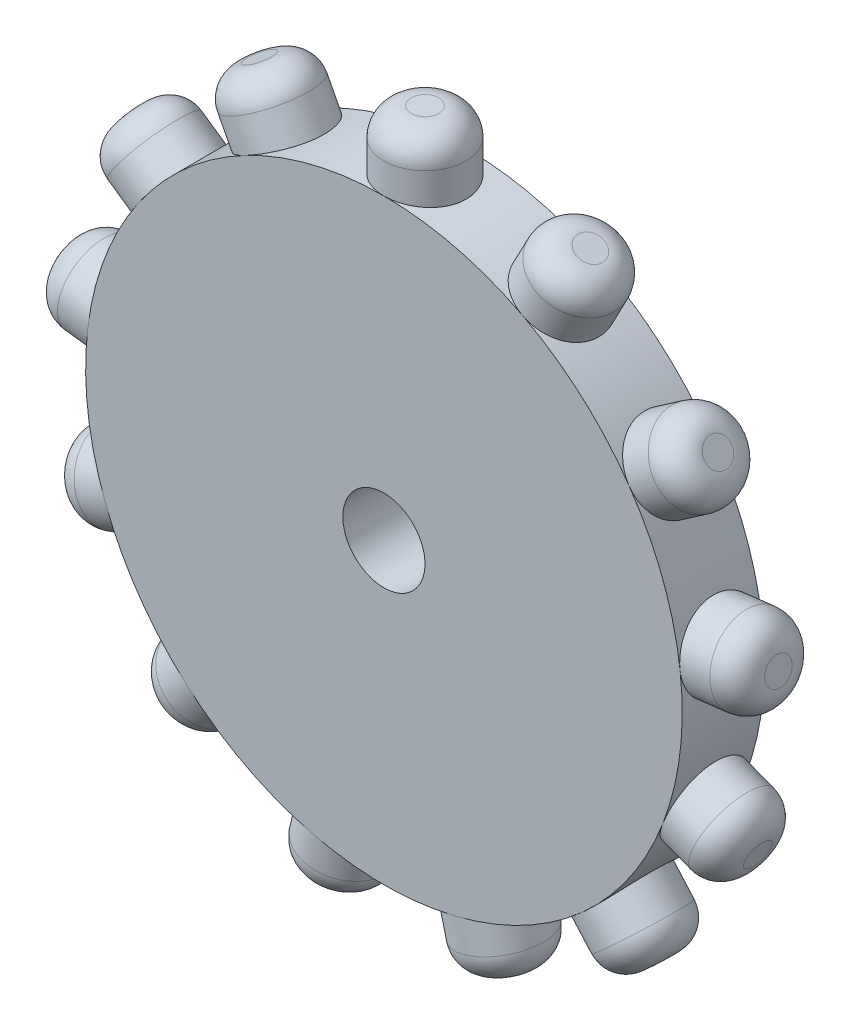
from build123d import *
from build123d.topology import SkipClean

# Parameters (mm, degrees)
SKETCH1_R                = 27.669253018
BOSS_EXTRUDE1_DEPTH      = 7.62
CUT_EXTRUDE2_REACH       = 41.865
SKETCH3_R                = 3.81
BOSS_EXTRUDE3_REACH      = 69.133
BOSS_EXTRUDE3_END_RADIUS = 27.669253018
SKETCH4_R                = 3.81
FILLET3_R                = 2.54
CIRPATTERN3_COUNT        = 13
FILLET3_OF_CIRPATTERN3_R = 2.54


with BuildPart() as part:
    # Sketch1 → Boss-Extrude1 (new body)
    with BuildSketch(Plane.XY):
        Circle(SKETCH1_R)
    extrude(amount=BOSS_EXTRUDE1_DEPTH)

    # Sketch3 → Cut-Extrude2 (cut, up to next)
    with BuildSketch(Plane(origin=(0, 0, 0), x_dir=(-1, 0, 0), z_dir=(0, 0, -1)), mode=Mode.PRIVATE) as cut_extrude2_sk1:
        Circle(SKETCH3_R)
    cut_extrude2_tool1 = extrude(cut_extrude2_sk1.sketch, amount=-CUT_EXTRUDE2_REACH, mode=Mode.PRIVATE) & part.part
    add(cut_extrude2_tool1.solids().sort_by_distance((0, 0, 0))[0], mode=Mode.SUBTRACT)

    # Boss-Extrude3: up to this cylinder (the profile starts outside it)
    with SkipClean():  # the faces are left unmerged after this step: merging them gives an invalid solid
        boss_extrude3_end = Plane(origin=(0, 0, 3.81), z_dir=(0, 0, -1)) * Cylinder(BOSS_EXTRUDE3_END_RADIUS, 194.604506036, mode=Mode.PRIVATE)
        # Sketch4 → Boss-Extrude3 (add, up to the surface)
        with BuildSketch(Plane(origin=(0, 33.02, 0), x_dir=(1, 0, 0), z_dir=(0, 1, 0)), mode=Mode.PRIVATE) as boss_extrude3_sk1:
            with Locations(Location((0, -3.81, 0), (0, 0, 270))):
                Circle(SKETCH4_R)
        boss_extrude3_tool1 = extrude(boss_extrude3_sk1.sketch, amount=-BOSS_EXTRUDE3_REACH, mode=Mode.PRIVATE) - boss_extrude3_end
        boss_extrude3 = boss_extrude3_tool1.solids().sort_by_distance((0, 33.02, 3.81))[0]
        add(boss_extrude3)

    # Fillet3
    fillet3_edges = [part.edges().sort_by_distance(p)[0] for p in [
        (0, 33.02, 0),
    ]]
    fillet(fillet3_edges, radius=FILLET3_R)

    # CirPattern3: Boss-Extrude3 ×13 about axis
    cirpattern3_axis = Axis((0, 0, 7.62), (0, 0, -1))
    for i in range(1, CIRPATTERN3_COUNT):
        add(boss_extrude3.rotate(cirpattern3_axis, i * 360 / CIRPATTERN3_COUNT))

    # Fillet3 of CirPattern3
    fillet3_of_cirpattern3_edges = [part.edges().sort_by_distance(p)[0] for p in [
        (15.345159141, 29.237757967, 0),
        (27.174927252, 18.757497937, 0),
        (32.779247023, 3.980121182, 0),
        (30.874236333, -11.70905337, 0),
        (21.896310175, -24.715824905, 0),
        (7.902203235, -32.060498811, 0),
        (-7.902203235, -32.060498811, 0),
        (-21.896310175, -24.715824905, 0),
        (-30.874236333, -11.70905337, 0),
        (-32.779247023, 3.980121182, 0),
        (-27.174927252, 18.757497937, 0),
        (-15.345159141, 29.237757967, 0),
    ]]
    fillet(fillet3_of_cirpattern3_edges, radius=FILLET3_OF_CIRPATTERN3_R)


solid = part.part
